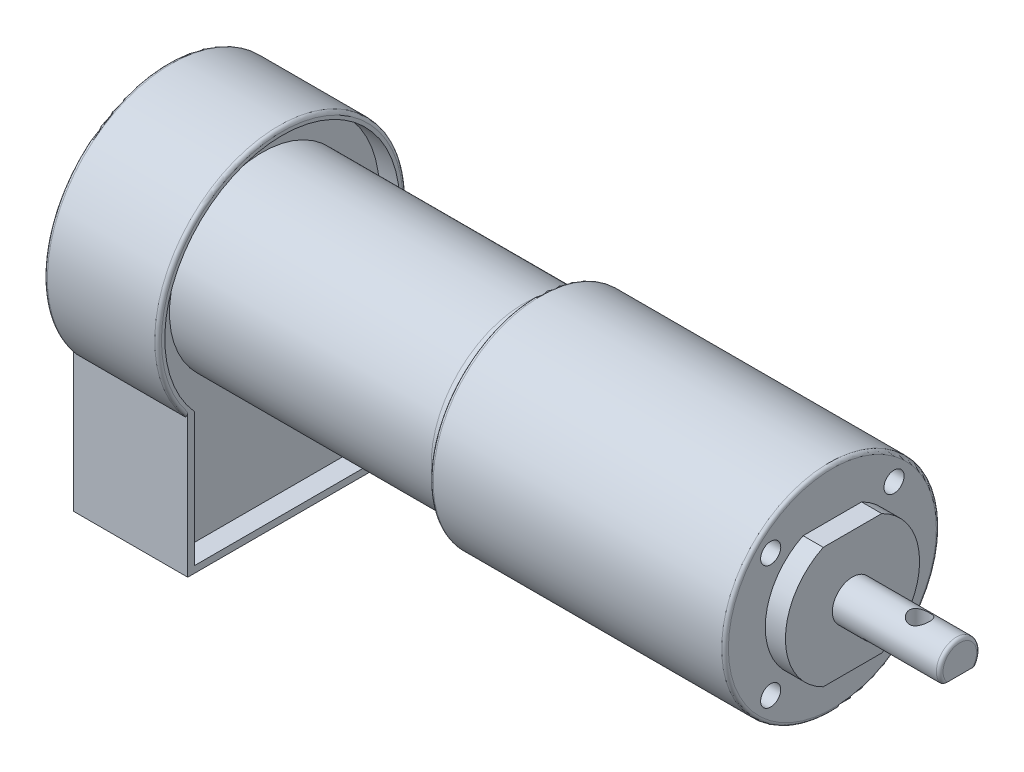
from build123d import *

# Parameters (mm, degrees)
BOSS_EXTRUDE1_DEPTH     = 17
CUT_EXTRUDE5_DEPTH      = 3
SKETCH2_R               = 13.8
BOSS_EXTRUDE2_DEPTH     = 41
FILLET1_R               = 2
SKETCH3_R               = 16
BOSS_EXTRUDE3_DEPTH     = 44
SKETCH4_R               = 1.5
CUT_EXTRUDE1_DEPTH      = 15
BOSS_EXTRUDE5_DEPTH     = 3
SKETCH6_R               = 3
BOSS_EXTRUDE6_DEPTH     = 16
CUT_EXTRUDE2_START      = -12
CUT_EXTRUDE2_DEPTH      = 12
FILLET2_R               = 0.5
CUT_EXTRUDE3_REACH      = 125.361
CUT_EXTRUDE3_END_RADIUS = 3
SKETCH8_R               = 1.5
CUT_EXTRUDE4_DEPTH      = 10


with BuildPart() as part:
    # Sketch1 → Boss-Extrude1 (new body)
    with BuildSketch(Plane(origin=(0, 0, 0), x_dir=(0, 0, -1), z_dir=(1, 0, 0))):
        with BuildLine():
            Line((-14.08012784, -12), (-14.08012784, -32.5))
            Line((-14.08012784, -32.5), (14.08012784, -32.5))
            Line((14.08012784, -32.5), (14.08012784, -12))
            ThreePointArc((14.08012784, -12), (0, 18.5), (-14.08012784, -12))
        make_face()
    extrude(amount=BOSS_EXTRUDE1_DEPTH)

    # Sketch10 → Cut-Extrude5 (cut)
    with BuildSketch(Plane(origin=(17, 0, 0), x_dir=(0, 0, -1), z_dir=(1, 0, 0))):
        with BuildLine():
            Line((13.08012784, -31.5), (-13.08012784, -31.5))
            Line((-13.08012784, -31.5), (-13.08012784, -11.6258443))
            ThreePointArc((-13.08012784, -11.6258443), (0, 17.5), (13.08012784, -11.6258443))
            Line((13.08012784, -11.6258443), (13.08012784, -31.5))
        make_face()
    extrude(amount=-CUT_EXTRUDE5_DEPTH, mode=Mode.SUBTRACT)

    # Sketch2 → Boss-Extrude2 (add)
    with BuildSketch(Plane(origin=(14, 0, 0), x_dir=(0, 0, -1), z_dir=(1, 0, 0))):
        Circle(SKETCH2_R)
    extrude(amount=BOSS_EXTRUDE2_DEPTH)

    # Fillet1
    fillet1_edges = [part.edges().sort_by_distance(p)[0] for p in [
        (55, 0, 13.8),
    ]]
    fillet(fillet1_edges, radius=FILLET1_R)

    # Sketch3 → Boss-Extrude3 (add)
    with BuildSketch(Plane(origin=(55, 0, 0), x_dir=(0, 0, -1), z_dir=(1, 0, 0))):
        Circle(SKETCH3_R)
    extrude(amount=BOSS_EXTRUDE3_DEPTH)

    # Sketch4 → Cut-Extrude1 (cut)
    with BuildSketch(Plane(origin=(99, 0, 0), x_dir=(0, 0, -1), z_dir=(1, 0, 0))):
        with Locations((-9.192388155, -9.192388155)):
            Circle(SKETCH4_R)
        with Locations((9.192388155, 9.192388155)):
            Circle(SKETCH4_R)
        with Locations((-9.192388155, 9.192388155)):
            Circle(SKETCH4_R)
        with Locations((9.192388155, -9.192388155)):
            Circle(SKETCH4_R)
    extrude(amount=-CUT_EXTRUDE1_DEPTH, mode=Mode.SUBTRACT)

    # Sketch5 → Boss-Extrude5 (add)
    with BuildSketch(Plane(origin=(99, 0, 0), x_dir=(0, 0, -1), z_dir=(1, 0, 0))):
        with BuildLine():
            Line((-4.358898944, -9), (4.358898944, -9))
            ThreePointArc((4.358898944, -9), (10, 0), (4.358898944, 9))
            Line((4.358898944, 9), (-4.358898944, 9))
            ThreePointArc((-4.358898944, 9), (-10, 0), (-4.358898944, -9))
        make_face()
    extrude(amount=BOSS_EXTRUDE5_DEPTH)

    # Sketch6 → Boss-Extrude6 (add)
    with BuildSketch(Plane(origin=(102, 0, 0), x_dir=(0, 0, -1), z_dir=(1, 0, 0))):
        Circle(SKETCH6_R)
    extrude(amount=BOSS_EXTRUDE6_DEPTH)

    # Sketch7 → Cut-Extrude2 (cut)
    with BuildSketch(Plane(origin=(118, 0, 0), x_dir=(0, 0, -1), z_dir=(1, 0, 0)).offset(CUT_EXTRUDE2_START)):
        with BuildLine():
            Line((-2.505493963, -1.65), (2.505493963, -1.65))
            ThreePointArc((2.505493963, -1.65), (0, -3), (-2.505493963, -1.65))
        make_face()
    extrude(amount=CUT_EXTRUDE2_DEPTH, mode=Mode.SUBTRACT)

    # Fillet2
    fillet2_edges = [part.edges().sort_by_distance(p)[0] for p in [
        (17, 18.5, 0),
        (55, 0, 16),
        (99, 0, 16),
        (0, 18.5, 0),
        (118, 2.87371553, 0.86125435),
    ]]
    fillet(fillet2_edges, radius=FILLET2_R)

    # Cut-Extrude3: up to this cylinder (the profile starts inside it)
    cut_extrude3_end = Plane(origin=(112, 0, 0), z_dir=(-1, 0, 0)) * Cylinder(CUT_EXTRUDE3_END_RADIUS, 257.722, mode=Mode.PRIVATE)
    # Sketch8 → Cut-Extrude3 (cut, up to the surface)
    with BuildSketch(Plane.XZ.offset(1.65), mode=Mode.PRIVATE) as cut_extrude3_sk1:
        with Locations(Location((112, 0, 0), (0, 0, 270))):
            Circle(SKETCH8_R)
    cut_extrude3_tool1 = extrude(cut_extrude3_sk1.sketch, amount=-CUT_EXTRUDE3_REACH, mode=Mode.PRIVATE) & cut_extrude3_end
    add(cut_extrude3_tool1.solids().sort_by_distance((112, -1.65, 0))[0], mode=Mode.SUBTRACT)

    # Sketch9 → Cut-Extrude4 (cut)
    with BuildSketch(Plane.ZY):
        with BuildLine():
            Line((13.08012784, -31.5), (-13.08012784, -31.5))
            Line((-13.08012784, -31.5), (-13.08012784, -11.213830746))
            Line((-13.08012784, -11.213830746), (-11.461731339, -11.213830746))
            ThreePointArc((-11.461731339, -11.213830746), (0, -16.03500188), (11.461731339, -11.213830746))
            Line((11.461731339, -11.213830746), (13.08012784, -11.213830746))
            Line((13.08012784, -11.213830746), (13.08012784, -31.5))
        make_face()
    extrude(amount=-CUT_EXTRUDE4_DEPTH, mode=Mode.SUBTRACT)


solid = part.part
